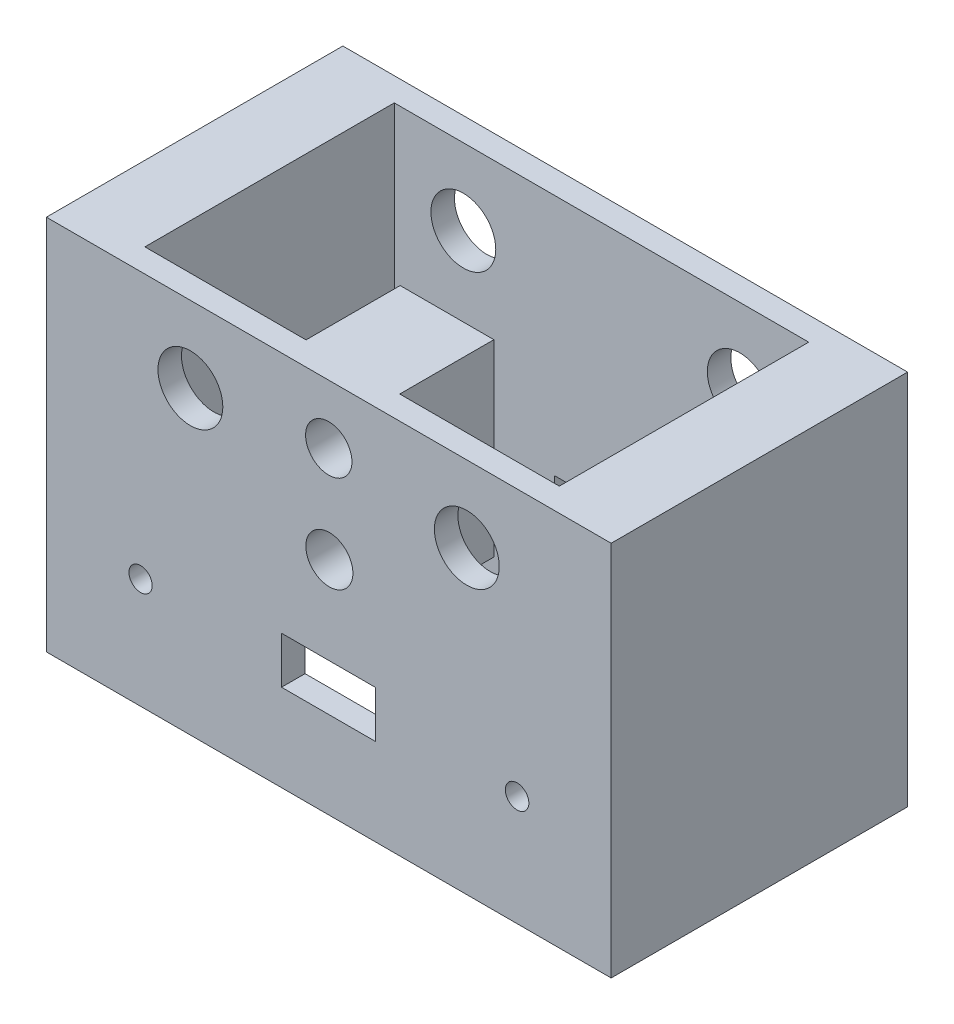
from build123d import *

# Parameters (mm, degrees)
SKETCH2_R           = 8.75000028
SKETCH2_R_2         = 3.175
SKETCH2_W           = 25.3952265
SKETCH2_H           = 12.629529533
SKETCH2_R_3         = 3.142219065
BOSS_EXTRUDE1_DEPTH = 80.000094
CUT_EXTRUDE2_DEPTH  = 179.822094
SKETCH6_R           = 6.35
SKETCH6_R_2         = 6.248785159
CUT_EXTRUDE6_DEPTH  = 41.402
BOSS_EXTRUDE4_START = 25.4
SKETCH6_10_R        = 6.35
SKETCH6_10_R_2      = 6.248785159
BOSS_EXTRUDE4_DEPTH = 25.4


with BuildPart() as part:
    # Sketch2 → Boss-Extrude1 (new body)
    with BuildSketch(Plane.XY):
        Polygon((0, 0), (0, 81.061351085), (0, 101.6), (-152.4, 101.6), (-152.4, 81.061351085), (-152.4, 0), align=None)
        with Locations((-113.538, 81.061351085)):
            Circle(SKETCH2_R, mode=Mode.SUBTRACT)
        with Locations((-38.952133661, 81.061351085)):
            Circle(SKETCH2_R, mode=Mode.SUBTRACT)
        with Locations((-25.384472284, 29.74542377)):
            Circle(SKETCH2_R_2, mode=Mode.SUBTRACT)
        with Locations((-76.249140265, 29.791740678)):
            Rectangle(SKETCH2_W, SKETCH2_H, mode=Mode.SUBTRACT)
        with Locations((-126.984472284, 29.74542377)):
            Circle(SKETCH2_R_3, mode=Mode.SUBTRACT)
    extrude(amount=BOSS_EXTRUDE1_DEPTH)

    # Sketch3 → Cut-Extrude2 (cut)
    with BuildSketch(Plane(origin=(0, 101.6, 0), x_dir=(1, 0, 0), z_dir=(0, 1, 0))):
        Polygon((-132.170994975, -73.650094), (-76.2, -73.650094), (-20.334810309, -73.650094), (-20.334810309, -6.35), (-76.2, -6.35), (-132.170994975, -6.35), align=None)
    extrude(amount=-CUT_EXTRUDE2_DEPTH, mode=Mode.SUBTRACT)

    # Sketch6 → Cut-Extrude6 (cut)
    with BuildSketch(Plane(origin=(0, 0, 73.650094), x_dir=(-1, 0, 0), z_dir=(0, 0, -1))):
        with Locations((76.041292075, 59.740546456)):
            Circle(SKETCH6_R)
        with Locations((76.2, 85.662840915)):
            Circle(SKETCH6_R_2)
    extrude(amount=-CUT_EXTRUDE6_DEPTH, mode=Mode.SUBTRACT)

    # Sketch6<10> → Boss-Extrude4 (add)
    with BuildSketch(Plane(origin=(0, 0, 73.650094), x_dir=(-1, 0, 0), z_dir=(0, 0, -1)).offset(BOSS_EXTRUDE4_START)):
        Polygon((76.2, 101.6), (63.397560696, 101.6), (63.397560696, 50.8), (88.685023454, 50.8), (88.685023454, 101.6), align=None)
        with Locations((76.041292075, 59.740546456)):
            Circle(SKETCH6_10_R, mode=Mode.SUBTRACT)
        with Locations((76.2, 85.662840915)):
            Circle(SKETCH6_10_R_2, mode=Mode.SUBTRACT)
    extrude(amount=-BOSS_EXTRUDE4_DEPTH)


solid = part.part
